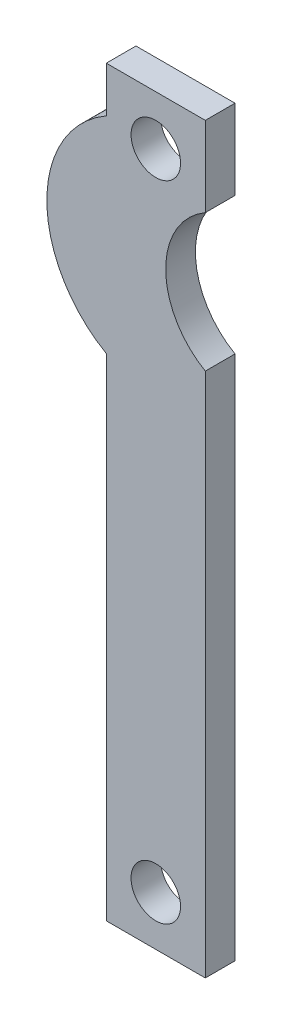
from build123d import *

# Parameters (mm, degrees)
SCHIZZO1_R                   = 2.5
ESTRUSIONE_ESTRUSIONE3_DEPTH = 3


with BuildPart() as part:
    # Schizzo1 → Estrusione-Estrusione3 (new body)
    with BuildSketch(Plane.XY):
        with BuildLine():
            Line((-10, 75), (0, 75))
            Line((0, 75), (0, 66.92820323))
            ThreePointArc((0, 66.92820323), (-4, 60), (0, 53.07179677))
            Line((0, 53.07179677), (0, 0))
            Line((0, 0), (-10, 0))
            Line((-10, 0), (-10, 49.607695155))
            ThreePointArc((-10, 49.607695155), (-16, 60), (-10, 70.392304845))
            Line((-10, 70.392304845), (-10, 75))
        make_face()
        with Locations((-5, 70)):
            Circle(SCHIZZO1_R, mode=Mode.SUBTRACT)
        with Locations((-5, 5)):
            Circle(SCHIZZO1_R, mode=Mode.SUBTRACT)
    extrude(amount=ESTRUSIONE_ESTRUSIONE3_DEPTH)


solid = part.part
